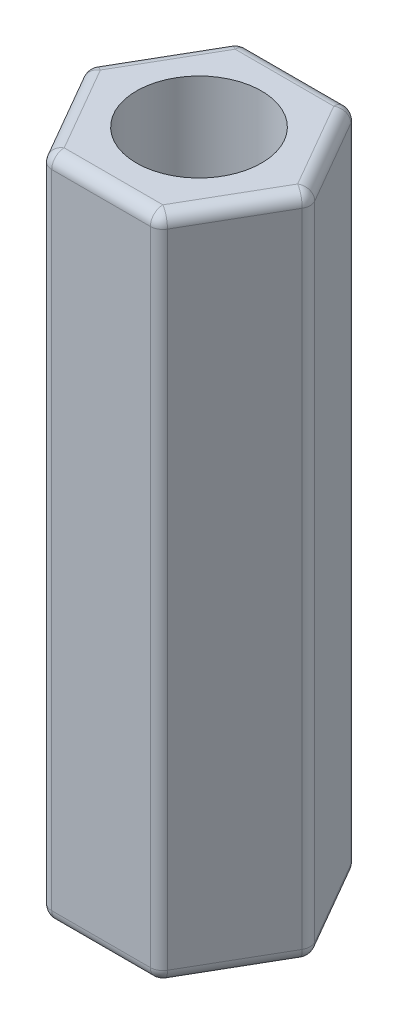
from build123d import *

# Parameters (mm, degrees)
SKETCH_1_R      = 1.5
EXTRUDE_1_DEPTH = 16
FILLET_1_R      = 0.3


with BuildPart() as part:
    # 草图1 → 凸台-拉伸1 (new body)
    with BuildSketch(Plane(origin=(0, 0, 0), x_dir=(1, 0, 0), z_dir=(0, 1, 0))):
        Polygon((2.713546265, 0), (1.356773133, 2.35), (-1.356773133, 2.35), (-2.713546265, 0), (-1.356773133, -2.35), (1.356773133, -2.35), align=None)
        with Locations(Location((0, 0, 0), (0, 0, 270))):
            Circle(SKETCH_1_R, mode=Mode.SUBTRACT)
    extrude(amount=EXTRUDE_1_DEPTH)

    # 圆角1
    fillet_1_edges = [part.edges().sort_by_distance(p)[0] for p in [
        (0, 16, -2.35),
        (1.356773133, 8, 2.35),
        (-1.356773133, 8, 2.35),
        (-2.713546265, 8, 0),
        (-1.356773133, 8, -2.35),
        (1.356773133, 8, -2.35),
        (2.713546265, 8, 0),
        (-2.035159699, 16, -1.175),
        (-2.035159699, 16, 1.175),
        (0, 16, 2.35),
        (2.035159699, 16, 1.175),
        (0, 0, 2.35),
        (-2.035159699, 0, 1.175),
        (-2.035159699, 0, -1.175),
        (2.035159699, 16, -1.175),
        (0, 0, -2.35),
        (2.035159699, 0, -1.175),
        (2.035159699, 0, 1.175),
    ]]
    fillet(fillet_1_edges, radius=FILLET_1_R)


solid = part.part
